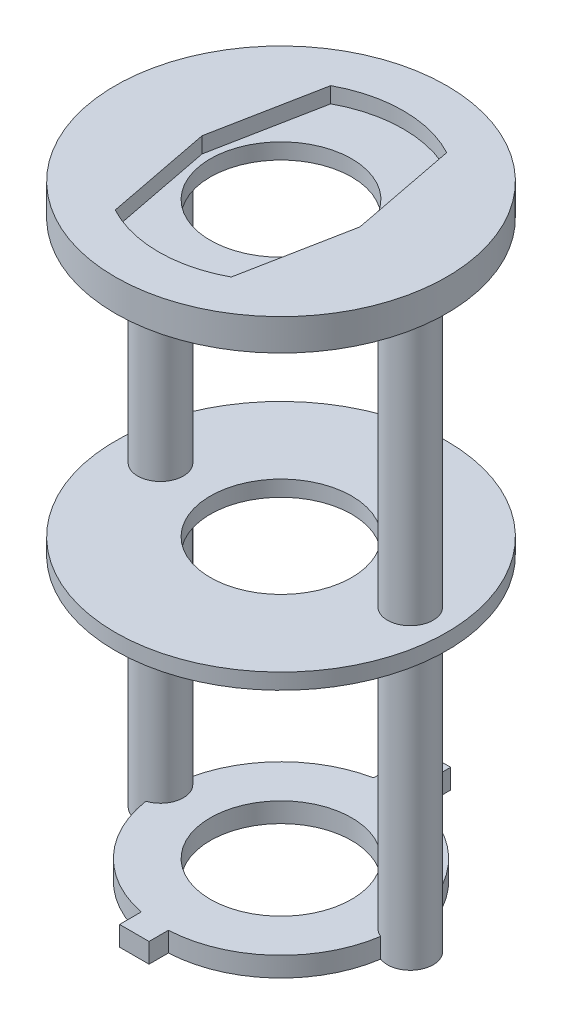
from build123d import *

# Parameters (mm, degrees)
SKETCH2_R           = 1.715
SKETCH2_R_2         = 8.955
BOSS_EXTRUDE1_DEPTH = 2.5
BOSS_EXTRUDE2_START = 70.305
SKETCH3_R           = 1.715
SKETCH3_R_2         = 2.896004293
BOSS_EXTRUDE2_DEPTH = 70.305
BOSS_EXTRUDE3_START = 4
SKETCH4_R           = 21
SKETCH4_R_2         = 8.955
BOSS_EXTRUDE3_DEPTH = 4
CUT_EXTRUDE1_DEPTH  = 2
SKETCH6_R           = 21
SKETCH6_R_2         = 8.955
BOSS_EXTRUDE4_DEPTH = 2
CUT_EXTRUDE2_START  = -15
SKETCH7_R           = 1.715
CUT_EXTRUDE2_DEPTH  = 15


with BuildPart() as part:
    # Sketch2 → Boss-Extrude1 (new body)
    with BuildSketch(Plane(origin=(0, 0, 0), x_dir=(1, 0, 0), z_dir=(0, 1, 0))):
        with BuildLine():
            ThreePointArc((14.854844323, -2.224127391), (18.801958936, 0.560128045), (14.69610016, 3.104477828))
            ThreePointArc((14.69610016, 3.104477828), (9.742901135, 11.431929845), (0.735551003, 15.002403382))
            Line((0.735551003, 15.002403382), (0.735551003, 20.759778141))
            Line((0.735551003, 20.759778141), (-2.9930124, 20.759778141))
            Line((-2.9930124, 20.759778141), (-2.9930124, 14.719205797))
            ThreePointArc((-2.9930124, 14.719205797), (-10.557124207, 10.684580992), (-14.68222924, 3.169430082))
            ThreePointArc((-14.68222924, 3.169430082), (-18.635653921, 0.561038173), (-14.846301483, -2.280454949))
            ThreePointArc((-14.846301483, -2.280454949), (-10.873863647, -10.362057319), (-2.9930124, -14.719205797))
            Line((-2.9930124, -14.719205797), (-2.9930124, -17.45639334))
            Line((-2.9930124, -17.45639334), (0.735551003, -17.45639334))
            Line((0.735551003, -17.45639334), (0.735551003, -15.002403382))
            ThreePointArc((0.735551003, -15.002403382), (10.078997516, -11.136738821), (14.854844323, -2.224127391))
        make_face()
        with Locations(Location((15.90723889, 0.473891612, 0), (0, 0, 270))):
            Circle(SKETCH2_R, mode=Mode.SUBTRACT)
        with Locations(Location((-15.740961132, 0.473891612, 0), (0, 0, 270))):
            Circle(SKETCH2_R, mode=Mode.SUBTRACT)
        with Locations(Location((0, 0, 0), (0, 0, 270))):
            Circle(SKETCH2_R_2, mode=Mode.SUBTRACT)
    extrude(amount=-BOSS_EXTRUDE1_DEPTH)

    # Sketch3 → Boss-Extrude2 (add)
    # profile 1 of 3: a face of its own
    with BuildSketch(Plane(origin=(0, 0, 0), x_dir=(1, 0, 0), z_dir=(0, 1, 0)).offset(BOSS_EXTRUDE2_START)):
        with BuildLine():
            ThreePointArc((14.854844323, -2.224127391), (17.541114907, -1.917193921), (18.803243183, 0.473891612))
            ThreePointArc((18.803243183, 0.473891612), (17.469189258, 2.912569924), (14.69610016, 3.104477828))
            ThreePointArc((14.69610016, 3.104477828), (13.012518845, 0.387655178), (14.854844323, -2.224127391))
        make_face()
        with Locations(Location((15.90723889, 0.473891612, 0), (0, 0, 270))):
            Circle(SKETCH3_R, mode=Mode.SUBTRACT)
    # profile 2 of 3: a face of its own
    with BuildSketch(Plane(origin=(0, 0, 0), x_dir=(1, 0, 0), z_dir=(0, 1, 0)).offset(BOSS_EXTRUDE2_START)):
        with Locations(Location((15.90723889, 0.473891612, 0), (0, 0, 270))):
            Circle(SKETCH3_R)
    # profile 3 of 3: a face of its own
    with BuildSketch(Plane(origin=(0, 0, 0), x_dir=(1, 0, 0), z_dir=(0, 1, 0)).offset(BOSS_EXTRUDE2_START)):
        with Locations(Location((-15.740961132, 0.473891612, 0), (0, 0, 270))):
            Circle(SKETCH3_R_2)
    extrude(amount=-BOSS_EXTRUDE2_DEPTH)

    # Sketch4 → Boss-Extrude3 (add)
    with BuildSketch(Plane(origin=(0, 70.305, 0), x_dir=(1, 0, 0), z_dir=(0, 1, 0)).offset(BOSS_EXTRUDE3_START)):
        with Locations(Location((0, 0, 0), (0, 0, 270))):
            Circle(SKETCH4_R)
        with Locations(Location((0, 0, 0), (0, 0, 270))):
            Circle(SKETCH4_R_2, mode=Mode.SUBTRACT)
    extrude(amount=-BOSS_EXTRUDE3_DEPTH)

    # Sketch5 → Cut-Extrude1 (cut)
    with BuildSketch(Plane(origin=(0, 74.305, 0), x_dir=(1, 0, 0), z_dir=(0, 1, 0))):
        with BuildLine():
            Line((-7.35, 13.646519703), (-10, -0.003480297))
            Line((-10, -0.003480297), (-7.35, -13.653480297))
            ThreePointArc((-7.35, -13.653480297), (0, -15.506960594), (7.35, -13.653480297))
            Line((7.35, -13.653480297), (10, -0.003480297))
            Line((10, -0.003480297), (7.35, 13.646519703))
            ThreePointArc((7.35, 13.646519703), (0, 15.5), (-7.35, 13.646519703))
        make_face()
    extrude(amount=-CUT_EXTRUDE1_DEPTH, mode=Mode.SUBTRACT)

    # Sketch6 → Boss-Extrude4 (add)
    with BuildSketch(Plane(origin=(0, 35.305, 0), x_dir=(-1, 0, 0), z_dir=(0, -1, 0))):
        with Locations(Location((0, 0, 0), (0, 0, 270))):
            Circle(SKETCH6_R)
        with Locations(Location((0, 0, 0), (0, 0, 90))):
            Circle(SKETCH6_R_2, mode=Mode.SUBTRACT)
    extrude(amount=BOSS_EXTRUDE4_DEPTH)

    # Sketch7 → Cut-Extrude2 (cut)
    with BuildSketch(Plane.XZ.offset(2.5).offset(CUT_EXTRUDE2_START)):
        with Locations(Location((-15.740961132, -0.473891612, 0), (0, 0, 90))):
            Circle(SKETCH7_R)
        with Locations(Location((15.90723889, -0.473891612, 0), (0, 0, 90))):
            Circle(SKETCH7_R)
    extrude(amount=CUT_EXTRUDE2_DEPTH, mode=Mode.SUBTRACT)


solid = part.part
